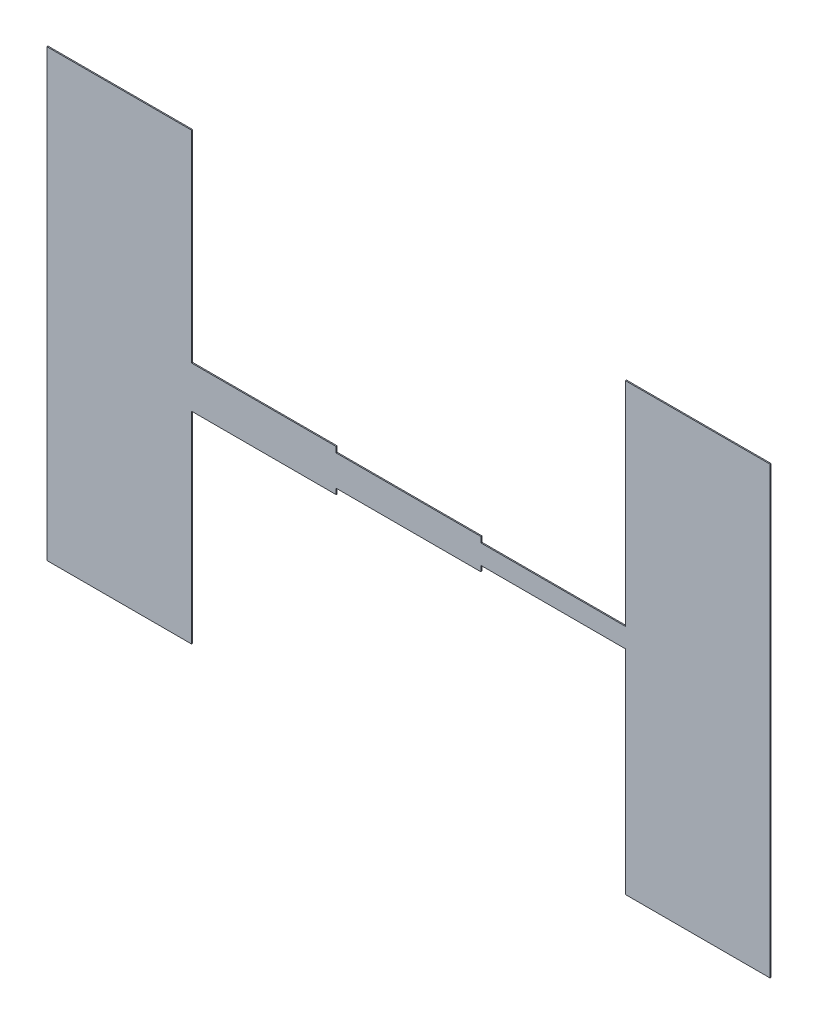
from build123d import *

# Parameters (mm, degrees)
BOSS_EXTRUDE1_DEPTH = 10


with BuildPart() as part:
    # Sketch1 → Boss-Extrude1 (new body)
    with BuildSketch(Plane.XY):
        Polygon((-650, -2000), (650, -2000), (650, -187.5), (1950, -187.5), (1950, -137.5), (3250, -137.5), (3250, -87.5), (4550, -87.5), (4550, -2000), (5850, -2000), (5850, 2000), (4550, 2000), (4550, 87.5), (3250, 87.5), (3250, 137.5), (1950, 137.5), (1950, 187.5), (650, 187.5), (650, 2000), (-650, 2000), align=None)
    extrude(amount=BOSS_EXTRUDE1_DEPTH)


solid = part.part
